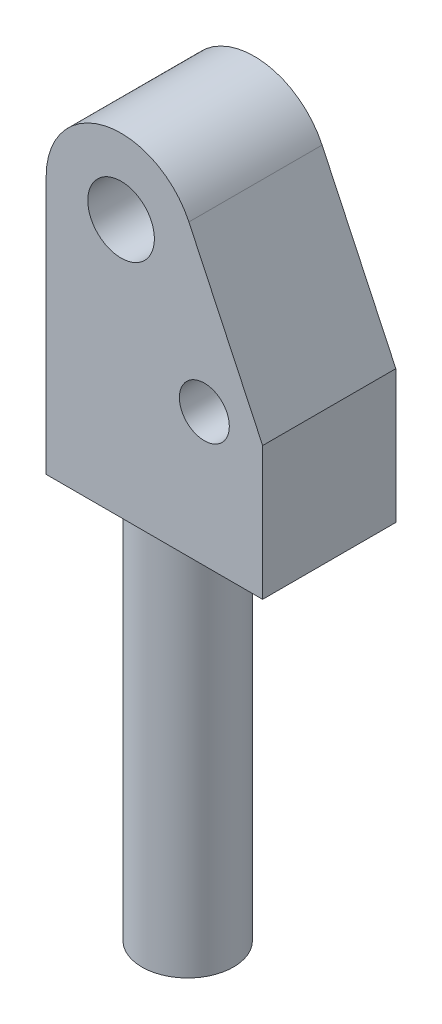
from build123d import *

# Parameters (mm, degrees)
SKETCH2_R           = 5.5
BOSS_EXTRUDE1_DEPTH = 48
SKETCH3_R           = 4
SKETCH3_R_2         = 3
BOSS_EXTRUDE2_DEPTH = 8
CHAMFER1_SIZE       = 1


with BuildPart() as part:
    # Sketch2 → Boss-Extrude1 (new body)
    with BuildSketch(Plane(origin=(0, 0, 0), x_dir=(1, 0, 0), z_dir=(0, 1, 0))):
        with Locations(Location((0, 0, 0), (0, 0, 270))):
            Circle(SKETCH2_R)
    extrude(amount=BOSS_EXTRUDE1_DEPTH)

    # Sketch3 → Boss-Extrude2 (add, symmetric)
    with BuildSketch(Plane.XY):
        with BuildLine():
            Line((-9, 79), (-9, 48))
            Line((-9, 48), (17, 48))
            Line((17, 48), (17, 64))
            Line((17, 64), (8.144295771, 82.830201874))
            ThreePointArc((8.144295771, 82.830201874), (-1.962312164, 87.783469188), (-9, 79))
        make_face()
        with Locations((0, 79)):
            Circle(SKETCH3_R, mode=Mode.SUBTRACT)
        with Locations((10, 64)):
            Circle(SKETCH3_R_2, mode=Mode.SUBTRACT)
    extrude(amount=BOSS_EXTRUDE2_DEPTH, both=True)

    # Chamfer1
    chamfer1_edges = [part.edges().sort_by_distance(p)[0] for p in [
        (0, 48, -5.5),
    ]]
    chamfer(chamfer1_edges, length=CHAMFER1_SIZE)


solid = part.part
